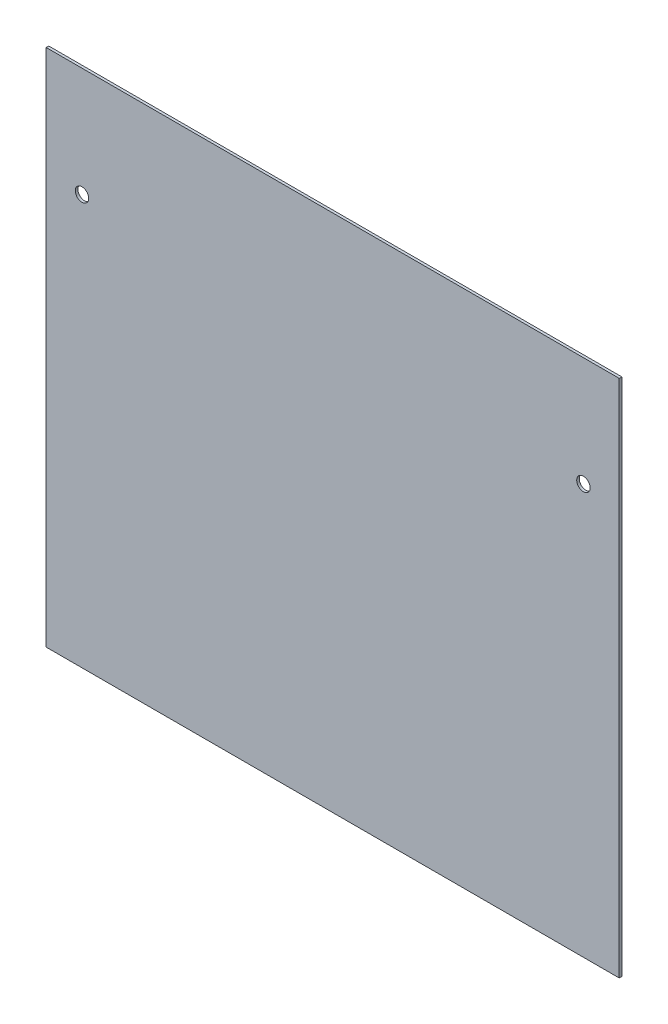
from build123d import *

# Parameters (mm, degrees)
SKETCH2_W               = 288
SKETCH2_H               = 261
BOSS_EXTRUDE1_DEPTH     = 1.2954
F_1_4_CLEARANCE_HOLE1_D = 6.7564


with BuildPart() as part:
    # Sketch2 → Boss-Extrude1 (new body)
    with BuildSketch(Plane.XY):
        Rectangle(SKETCH2_W, SKETCH2_H)
    extrude(amount=BOSS_EXTRUDE1_DEPTH)

    # 1/4 Clearance Hole1 (through all)
    with Locations(Plane.XY.offset(1.2954)):
        with Locations((-126, 75.5), (126, 75.5)):
            Hole(F_1_4_CLEARANCE_HOLE1_D / 2)


solid = part.part
